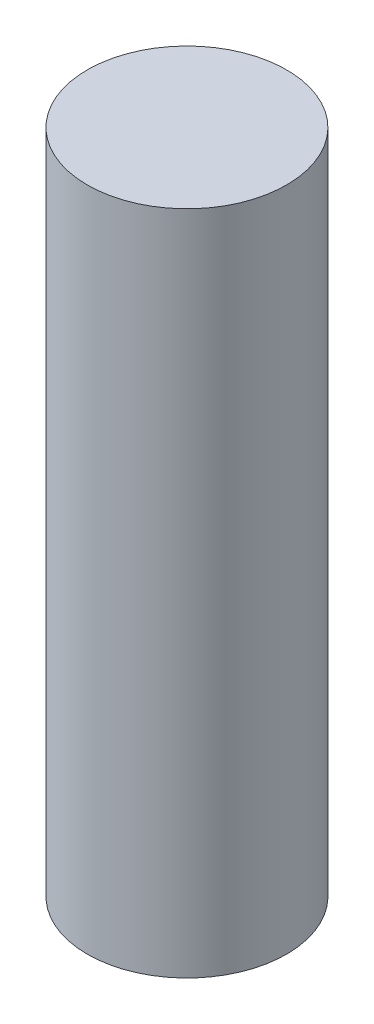
from build123d import *

# Parameters (mm, degrees)
SKETCH1_R           = 10.585
BOSS_EXTRUDE1_DEPTH = 70.73


with BuildPart() as part:
    # Sketch1 → Boss-Extrude1 (new body)
    with BuildSketch(Plane(origin=(0, 0, 0), x_dir=(1, 0, 0), z_dir=(0, 1, 0))):
        with Locations(Location((0, 0, 0), (0, 0, 270))):
            Circle(SKETCH1_R)
    extrude(amount=BOSS_EXTRUDE1_DEPTH)


solid = part.part
